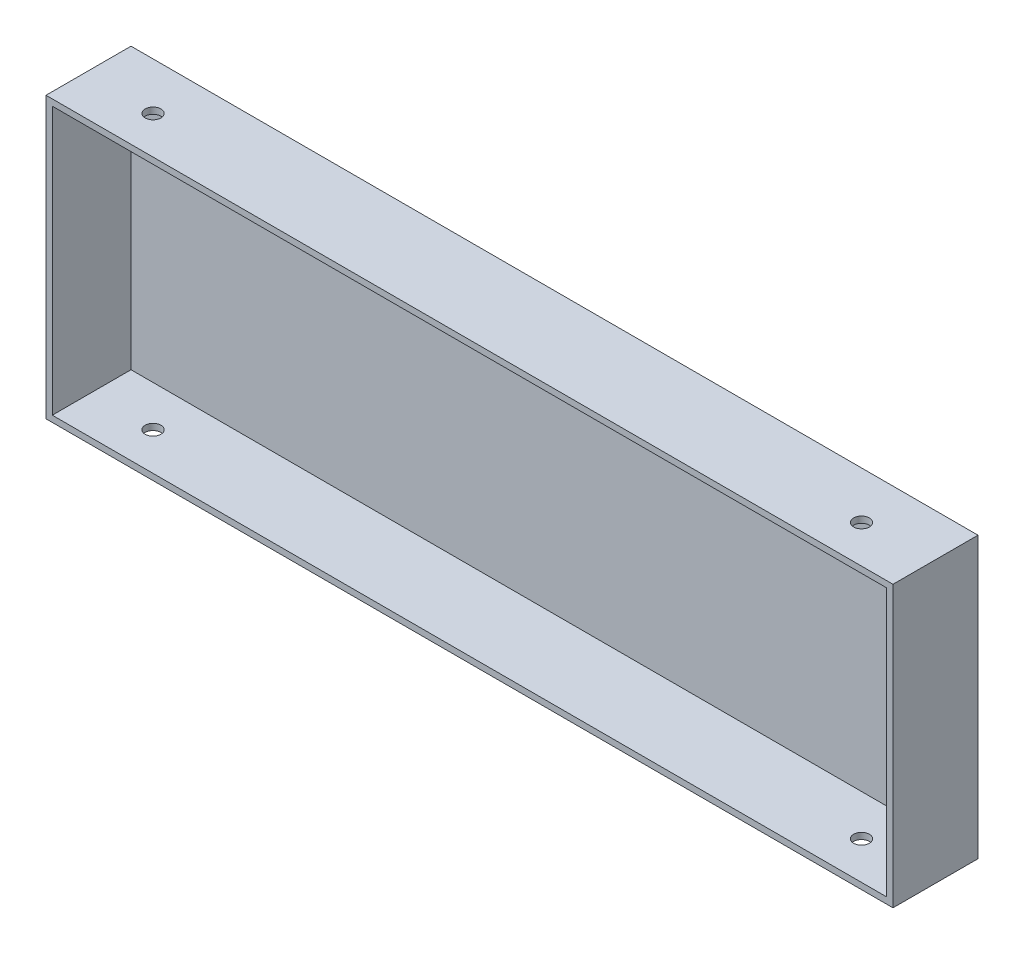
from build123d import *

# Parameters (mm, degrees)
SKETCH1_W           = 265
SKETCH1_H           = 85
BOSS_EXTRUDE2_DEPTH = 25
SHELL1_T            = 2
SKETCH3_W           = 50
SKETCH3_H           = 20
BOSS_EXTRUDE3_DEPTH = 1
SKETCH5_R           = 2.5
CUT_EXTRUDE1_DEPTH  = 87


with BuildPart() as part:
    # Sketch1 → Boss-Extrude2 (new body)
    with BuildSketch(Plane.XY):
        with Locations((132.5, 42.5)):
            Rectangle(SKETCH1_W, SKETCH1_H)
    extrude(amount=BOSS_EXTRUDE2_DEPTH)

    # Shell1
    shell1_openings = [part.faces().sort_by_distance(p)[0] for p in [
        (132.5, 42.5, 25),
    ]]
    offset(amount=SHELL1_T, openings=shell1_openings, kind=Kind.INTERSECTION)

    # Sketch3 → Boss-Extrude3 (add, symmetric)
    with BuildSketch(Plane(origin=(0, 42.5, 0), x_dir=(1, 0, 0), z_dir=(0, 1, 0))):
        with Locations((132.5, 12)):
            Rectangle(SKETCH3_W, SKETCH3_H)
    extrude(amount=BOSS_EXTRUDE3_DEPTH, both=True)

    # Sketch5 → Cut-Extrude1 (cut)
    with BuildSketch(Plane(origin=(0, 87, 0), x_dir=(1, 0, 0), z_dir=(0, 1, 0))):
        with Locations(Location((245, -13, 0), (0, 0, 270))):
            Circle(SKETCH5_R)
        with Locations(Location((20, -13, 0), (0, 0, 270))):
            Circle(SKETCH5_R)
    cut_extrude1 = extrude(amount=-CUT_EXTRUDE1_DEPTH, mode=Mode.SUBTRACT)

    # Mirror1: Cut-Extrude1 across plane
    add(cut_extrude1.mirror(Plane.ZX.offset(42.5)), mode=Mode.SUBTRACT)


solid = part.part
